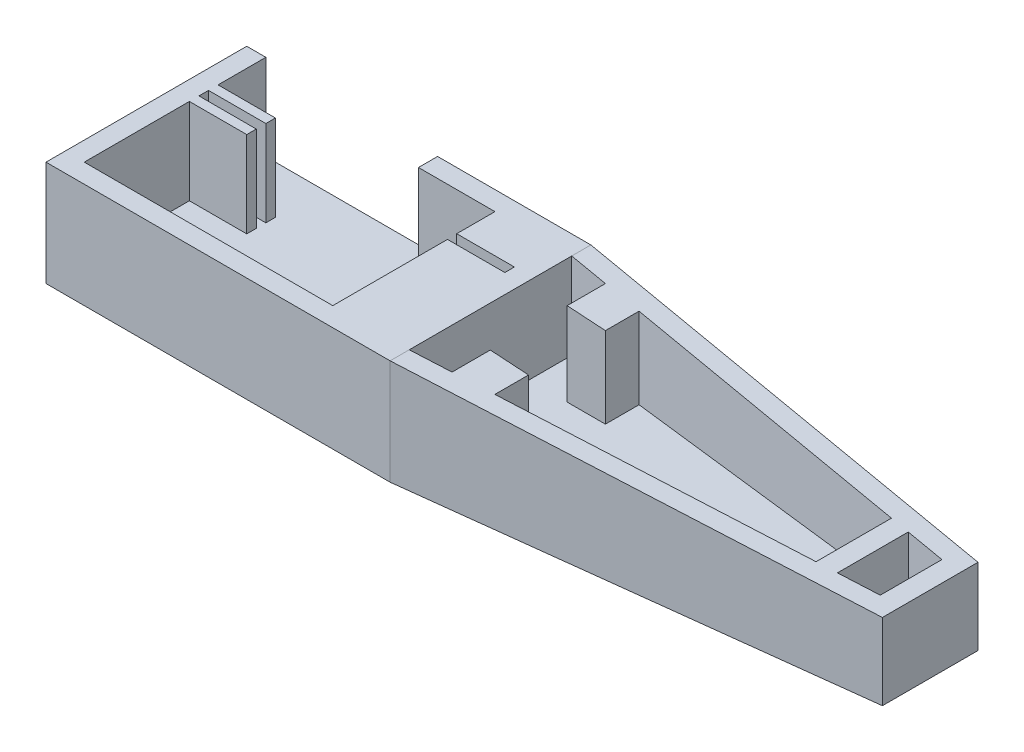
from build123d import *

# Parameters (mm, degrees)
BOSS_EXTRUDE1_DEPTH     = 2
BOSS_EXTRUDE2_DEPTH     = 11
CUT_EXTRUDE1_DEPTH      = 11
CUT_EXTRUDE1_DEPTH_BACK = 11


with BuildPart() as part:
    # Sketch1 → Boss-Extrude1 (new body)
    with BuildSketch(Plane(origin=(0, 0, 0), x_dir=(1, 0, 0), z_dir=(0, 1, 0))):
        Polygon((-42, 10.5), (-42, -10.5), (-6, -10.5), (40, -5), (40, 5), (-6, 10.5), align=None)
    extrude(amount=BOSS_EXTRUDE1_DEPTH)

    # Sketch1<5> → Boss-Extrude2 (add)
    with BuildSketch(Plane(origin=(0, 0, 0), x_dir=(1, 0, 0), z_dir=(0, 1, 0))):
        Polygon((-40, 10.5), (-42, 10.5), (-42, -10.5), (-6, -10.5), (40, -5), (40, 5), (-6, 10.5), (-22.03308425, 10.5), (-22.03308425, 8.5), (-14.03308425, 8.5), (-14.03308425, 4.5), (-8, 4.5), (-8, 3.5), (-14, 3.5), (-14, -8.5), (-40, -8.5), (-40, 2.5), (-34, 2.5), (-34, 3.5), (-40, 3.5), (-40, 4.5), (-34, 4.5), (-34, 5.5), (-40, 5.5), align=None)
        Polygon((-6, -8.5), (-6, 8.5), (-2, 8.02044412), (-2, 4.02044412), (2, 4.02044412), (2, 7.540888241), (32, 3.944219144), (32, -3.944219144), (2, -7.540888241), (2, -4.02044412), (-2, -4.02044412), (-2, -8.02044412), align=None, mode=Mode.SUBTRACT)
        Polygon((38, -3.224885324), (34, -3.704441204), (34, 3.704441204), (38, 3.224885324), align=None, mode=Mode.SUBTRACT)
    extrude(amount=BOSS_EXTRUDE2_DEPTH)

    # Sketch2 → Cut-Extrude1 (cut, two sides: drawn at the far end of the back side and taken through both)
    with BuildSketch(Plane.XY.offset(-CUT_EXTRUDE1_DEPTH_BACK)):
        Polygon((-6, 11), (40, 11), (40, 8), align=None)
    extrude(amount=CUT_EXTRUDE1_DEPTH + CUT_EXTRUDE1_DEPTH_BACK, mode=Mode.SUBTRACT)


solid = part.part
